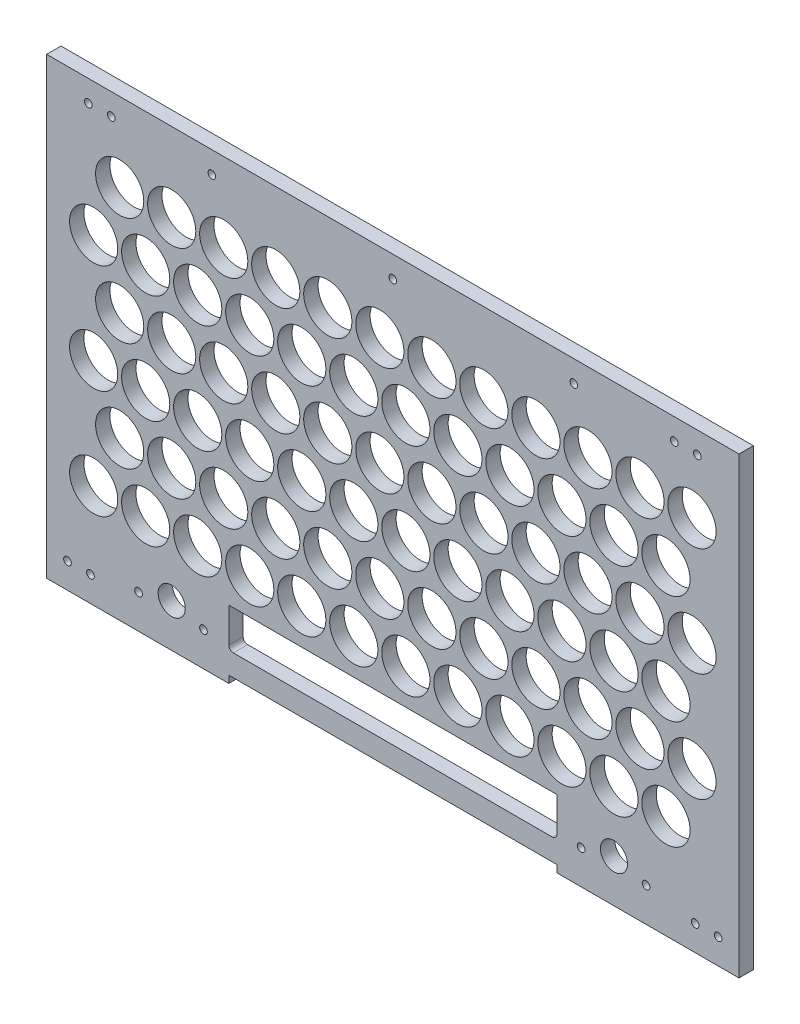
from build123d import *

# Parameters (mm, degrees)
SKETCH1_W                  = 306.05000007
SKETCH1_H                  = 197.4250001
BOSS_EXTRUDE1_DEPTH        = 6.35
SKETCH3_R                  = 10.6511979
CUT_EXTRUDE1_DEPTH         = 187.132543615
SKETCH4_R                  = 10.6511979
CUT_EXTRUDE2_DEPTH         = 187.132543615
LPATTERN1_COUNT            = 12
LPATTERN1_PITCH            = 23
LPATTERN2_COPY_1_SKETCH_R  = 10.6511979
LPATTERN2_COPY_1_DEPTH     = 187.132543615
LPATTERN2_COPY_2_SKETCH_R  = 10.6511979
LPATTERN2_COPY_2_DEPTH     = 187.132543615
LPATTERN2_COPY_3_SKETCH_R  = 10.6511979
LPATTERN2_COPY_3_DEPTH     = 187.132543615
LPATTERN2_COPY_4_SKETCH_R  = 10.6511979
LPATTERN2_COPY_4_DEPTH     = 187.132543615
LPATTERN2_COPY_5_SKETCH_R  = 10.6511979
LPATTERN2_COPY_5_DEPTH     = 187.132543615
LPATTERN2_COPY_6_SKETCH_R  = 10.6511979
LPATTERN2_COPY_6_DEPTH     = 187.132543615
LPATTERN2_COPY_7_SKETCH_R  = 10.6511979
LPATTERN2_COPY_7_DEPTH     = 187.132543615
LPATTERN2_COPY_8_SKETCH_R  = 10.6511979
LPATTERN2_COPY_8_DEPTH     = 187.132543615
LPATTERN2_COPY_9_SKETCH_R  = 10.6511979
LPATTERN2_COPY_9_DEPTH     = 187.132543615
LPATTERN2_COPY_10_SKETCH_R = 10.6511979
LPATTERN2_COPY_10_DEPTH    = 187.132543615
LPATTERN2_COPY_11_SKETCH_R = 10.6511979
LPATTERN2_COPY_11_DEPTH    = 187.132543615
LPATTERN2_COPY_12_SKETCH_R = 10.6511979
LPATTERN2_COPY_12_DEPTH    = 187.132543615
LPATTERN2_COPY_13_SKETCH_R = 10.6511979
LPATTERN2_COPY_13_DEPTH    = 187.132543615
LPATTERN2_COPY_14_SKETCH_R = 10.6511979
LPATTERN2_COPY_14_DEPTH    = 187.132543615
LPATTERN2_COPY_15_SKETCH_R = 10.6511979
LPATTERN2_COPY_15_DEPTH    = 187.132543615
LPATTERN2_COPY_16_SKETCH_R = 10.6511979
LPATTERN2_COPY_16_DEPTH    = 187.132543615
LPATTERN2_COPY_17_SKETCH_R = 10.6511979
LPATTERN2_COPY_17_DEPTH    = 187.132543615
LPATTERN2_COPY_18_SKETCH_R = 10.6511979
LPATTERN2_COPY_18_DEPTH    = 187.132543615
LPATTERN2_COPY_19_SKETCH_R = 10.6511979
LPATTERN2_COPY_19_DEPTH    = 187.132543615
LPATTERN2_COPY_20_SKETCH_R = 10.6511979
LPATTERN2_COPY_20_DEPTH    = 187.132543615
LPATTERN2_COPY_21_SKETCH_R = 10.6511979
LPATTERN2_COPY_21_DEPTH    = 187.132543615
LPATTERN2_COPY_22_SKETCH_R = 10.6511979
LPATTERN2_COPY_22_DEPTH    = 187.132543615
LPATTERN2_COPY_23_SKETCH_R = 10.6511979
LPATTERN2_COPY_23_DEPTH    = 187.132543615
LPATTERN2_COPY_24_SKETCH_R = 10.6511979
LPATTERN2_COPY_24_DEPTH    = 187.132543615
LPATTERN2_COPY_25_SKETCH_R = 10.6511979
LPATTERN2_COPY_25_DEPTH    = 187.132543615
LPATTERN2_COPY_26_SKETCH_R = 10.6511979
LPATTERN2_COPY_26_DEPTH    = 187.132543615
LPATTERN2_COPY_27_SKETCH_R = 10.6511979
LPATTERN2_COPY_27_DEPTH    = 187.132543615
LPATTERN2_COPY_28_SKETCH_R = 10.6511979
LPATTERN2_COPY_28_DEPTH    = 187.132543615
LPATTERN2_COPY_29_SKETCH_R = 10.6511979
LPATTERN2_COPY_29_DEPTH    = 187.132543615
LPATTERN2_COPY_30_SKETCH_R = 10.6511979
LPATTERN2_COPY_30_DEPTH    = 187.132543615
LPATTERN2_COPY_31_SKETCH_R = 10.6511979
LPATTERN2_COPY_31_DEPTH    = 187.132543615
LPATTERN2_COPY_32_SKETCH_R = 10.6511979
LPATTERN2_COPY_32_DEPTH    = 187.132543615
LPATTERN2_COPY_33_SKETCH_R = 10.6511979
LPATTERN2_COPY_33_DEPTH    = 187.132543615
LPATTERN2_COPY_34_SKETCH_R = 10.6511979
LPATTERN2_COPY_34_DEPTH    = 187.132543615
LPATTERN2_COPY_35_SKETCH_R = 10.6511979
LPATTERN2_COPY_35_DEPTH    = 187.132543615
LPATTERN2_COPY_36_SKETCH_R = 10.6511979
LPATTERN2_COPY_36_DEPTH    = 187.132543615
LPATTERN2_COPY_37_SKETCH_R = 10.6511979
LPATTERN2_COPY_37_DEPTH    = 187.132543615
LPATTERN2_COPY_38_SKETCH_R = 10.6511979
LPATTERN2_COPY_38_DEPTH    = 187.132543615
LPATTERN2_COPY_39_SKETCH_R = 10.6511979
LPATTERN2_COPY_39_DEPTH    = 187.132543615
LPATTERN2_COPY_40_SKETCH_R = 10.6511979
LPATTERN2_COPY_40_DEPTH    = 187.132543615
LPATTERN2_COPY_41_SKETCH_R = 10.6511979
LPATTERN2_COPY_41_DEPTH    = 187.132543615
LPATTERN2_COPY_42_SKETCH_R = 10.6511979
LPATTERN2_COPY_42_DEPTH    = 187.132543615
LPATTERN2_COPY_43_SKETCH_R = 10.6511979
LPATTERN2_COPY_43_DEPTH    = 187.132543615
LPATTERN2_COPY_44_SKETCH_R = 10.6511979
LPATTERN2_COPY_44_DEPTH    = 187.132543615
LPATTERN2_COPY_45_SKETCH_R = 10.6511979
LPATTERN2_COPY_45_DEPTH    = 187.132543615
LPATTERN2_COPY_46_SKETCH_R = 10.6511979
LPATTERN2_COPY_46_DEPTH    = 187.132543615
LPATTERN2_COPY_47_SKETCH_R = 10.6511979
LPATTERN2_COPY_47_DEPTH    = 187.132543615
LPATTERN2_COPY_48_SKETCH_R = 10.6511979
LPATTERN2_COPY_48_DEPTH    = 187.132543615
SKETCH13_W                 = 306.05000007
SKETCH13_H                 = 6.35
BOSS_EXTRUDE2_DEPTH        = 3.175
SKETCH14_R                 = 6
CUT_EXTRUDE3_DEPTH         = 187.132543615
M3_CLEARANCE_HOLE1_D       = 3.4
SKETCH18_W                 = 145
SKETCH18_H                 = 6.35
CUT_EXTRUDE5_DEPTH         = 30
SKETCH19_W                 = 145
SKETCH19_H                 = 9.525
BOSS_EXTRUDE3_DEPTH        = 6.35
FILLET2_R                  = 2


with BuildPart() as part:
    # Sketch1 → Boss-Extrude1 (new body)
    with BuildSketch(Plane.XY):
        with Locations((3.5e-08, -7.06250005)):
            Rectangle(SKETCH1_W, SKETCH1_H)
    extrude(amount=BOSS_EXTRUDE1_DEPTH)

    # Sketch3 → Cut-Extrude1 (cut, through all)
    with BuildSketch(Plane.XY.offset(6.35)):
        with Locations((-132.25, -60)):
            Circle(SKETCH3_R)
    cut_extrude1 = extrude(amount=-CUT_EXTRUDE1_DEPTH, mode=Mode.SUBTRACT)

    # Sketch4 → Cut-Extrude2 (cut, through all)
    with BuildSketch(Plane.XY.offset(6.35)):
        with Locations((-120.75, -36)):
            Circle(SKETCH4_R)
    cut_extrude2 = extrude(amount=-CUT_EXTRUDE2_DEPTH, mode=Mode.SUBTRACT)

    # LPattern1: Cut-Extrude1, Cut-Extrude2 ×12
    with Locations(*[(i * LPATTERN1_PITCH, 0, 0) for i in range(1, LPATTERN1_COUNT)]):
        add(cut_extrude1, mode=Mode.SUBTRACT)
        add(cut_extrude2, mode=Mode.SUBTRACT)

    # LPattern2 copy 1 sketch → LPattern2 copy 1 (cut, through all)
    with BuildSketch(Plane(origin=(23, 48, 6.35), x_dir=(1, 0, 0), z_dir=(0, 0, 1))):
        with Locations((-132.25, -60)):
            Circle(LPATTERN2_COPY_1_SKETCH_R)
    extrude(amount=-LPATTERN2_COPY_1_DEPTH, mode=Mode.SUBTRACT)

    # LPattern2 copy 2 sketch → LPattern2 copy 2 (cut, through all)
    with BuildSketch(Plane(origin=(23, 96, 6.35), x_dir=(1, 0, 0), z_dir=(0, 0, 1))):
        with Locations((-132.25, -60)):
            Circle(LPATTERN2_COPY_2_SKETCH_R)
    extrude(amount=-LPATTERN2_COPY_2_DEPTH, mode=Mode.SUBTRACT)

    # LPattern2 copy 3 sketch → LPattern2 copy 3 (cut, through all)
    with BuildSketch(Plane(origin=(46, 48, 6.35), x_dir=(1, 0, 0), z_dir=(0, 0, 1))):
        with Locations((-132.25, -60)):
            Circle(LPATTERN2_COPY_3_SKETCH_R)
    extrude(amount=-LPATTERN2_COPY_3_DEPTH, mode=Mode.SUBTRACT)

    # LPattern2 copy 4 sketch → LPattern2 copy 4 (cut, through all)
    with BuildSketch(Plane(origin=(46, 96, 6.35), x_dir=(1, 0, 0), z_dir=(0, 0, 1))):
        with Locations((-132.25, -60)):
            Circle(LPATTERN2_COPY_4_SKETCH_R)
    extrude(amount=-LPATTERN2_COPY_4_DEPTH, mode=Mode.SUBTRACT)

    # LPattern2 copy 5 sketch → LPattern2 copy 5 (cut, through all)
    with BuildSketch(Plane(origin=(69, 48, 6.35), x_dir=(1, 0, 0), z_dir=(0, 0, 1))):
        with Locations((-132.25, -60)):
            Circle(LPATTERN2_COPY_5_SKETCH_R)
    extrude(amount=-LPATTERN2_COPY_5_DEPTH, mode=Mode.SUBTRACT)

    # LPattern2 copy 6 sketch → LPattern2 copy 6 (cut, through all)
    with BuildSketch(Plane(origin=(69, 96, 6.35), x_dir=(1, 0, 0), z_dir=(0, 0, 1))):
        with Locations((-132.25, -60)):
            Circle(LPATTERN2_COPY_6_SKETCH_R)
    extrude(amount=-LPATTERN2_COPY_6_DEPTH, mode=Mode.SUBTRACT)

    # LPattern2 copy 7 sketch → LPattern2 copy 7 (cut, through all)
    with BuildSketch(Plane(origin=(92, 48, 6.35), x_dir=(1, 0, 0), z_dir=(0, 0, 1))):
        with Locations((-132.25, -60)):
            Circle(LPATTERN2_COPY_7_SKETCH_R)
    extrude(amount=-LPATTERN2_COPY_7_DEPTH, mode=Mode.SUBTRACT)

    # LPattern2 copy 8 sketch → LPattern2 copy 8 (cut, through all)
    with BuildSketch(Plane(origin=(92, 96, 6.35), x_dir=(1, 0, 0), z_dir=(0, 0, 1))):
        with Locations((-132.25, -60)):
            Circle(LPATTERN2_COPY_8_SKETCH_R)
    extrude(amount=-LPATTERN2_COPY_8_DEPTH, mode=Mode.SUBTRACT)

    # LPattern2 copy 9 sketch → LPattern2 copy 9 (cut, through all)
    with BuildSketch(Plane(origin=(115, 48, 6.35), x_dir=(1, 0, 0), z_dir=(0, 0, 1))):
        with Locations((-132.25, -60)):
            Circle(LPATTERN2_COPY_9_SKETCH_R)
    extrude(amount=-LPATTERN2_COPY_9_DEPTH, mode=Mode.SUBTRACT)

    # LPattern2 copy 10 sketch → LPattern2 copy 10 (cut, through all)
    with BuildSketch(Plane(origin=(115, 96, 6.35), x_dir=(1, 0, 0), z_dir=(0, 0, 1))):
        with Locations((-132.25, -60)):
            Circle(LPATTERN2_COPY_10_SKETCH_R)
    extrude(amount=-LPATTERN2_COPY_10_DEPTH, mode=Mode.SUBTRACT)

    # LPattern2 copy 11 sketch → LPattern2 copy 11 (cut, through all)
    with BuildSketch(Plane(origin=(138, 48, 6.35), x_dir=(1, 0, 0), z_dir=(0, 0, 1))):
        with Locations((-132.25, -60)):
            Circle(LPATTERN2_COPY_11_SKETCH_R)
    extrude(amount=-LPATTERN2_COPY_11_DEPTH, mode=Mode.SUBTRACT)

    # LPattern2 copy 12 sketch → LPattern2 copy 12 (cut, through all)
    with BuildSketch(Plane(origin=(138, 96, 6.35), x_dir=(1, 0, 0), z_dir=(0, 0, 1))):
        with Locations((-132.25, -60)):
            Circle(LPATTERN2_COPY_12_SKETCH_R)
    extrude(amount=-LPATTERN2_COPY_12_DEPTH, mode=Mode.SUBTRACT)

    # LPattern2 copy 13 sketch → LPattern2 copy 13 (cut, through all)
    with BuildSketch(Plane(origin=(161, 48, 6.35), x_dir=(1, 0, 0), z_dir=(0, 0, 1))):
        with Locations((-132.25, -60)):
            Circle(LPATTERN2_COPY_13_SKETCH_R)
    extrude(amount=-LPATTERN2_COPY_13_DEPTH, mode=Mode.SUBTRACT)

    # LPattern2 copy 14 sketch → LPattern2 copy 14 (cut, through all)
    with BuildSketch(Plane(origin=(161, 96, 6.35), x_dir=(1, 0, 0), z_dir=(0, 0, 1))):
        with Locations((-132.25, -60)):
            Circle(LPATTERN2_COPY_14_SKETCH_R)
    extrude(amount=-LPATTERN2_COPY_14_DEPTH, mode=Mode.SUBTRACT)

    # LPattern2 copy 15 sketch → LPattern2 copy 15 (cut, through all)
    with BuildSketch(Plane(origin=(184, 48, 6.35), x_dir=(1, 0, 0), z_dir=(0, 0, 1))):
        with Locations((-132.25, -60)):
            Circle(LPATTERN2_COPY_15_SKETCH_R)
    extrude(amount=-LPATTERN2_COPY_15_DEPTH, mode=Mode.SUBTRACT)

    # LPattern2 copy 16 sketch → LPattern2 copy 16 (cut, through all)
    with BuildSketch(Plane(origin=(184, 96, 6.35), x_dir=(1, 0, 0), z_dir=(0, 0, 1))):
        with Locations((-132.25, -60)):
            Circle(LPATTERN2_COPY_16_SKETCH_R)
    extrude(amount=-LPATTERN2_COPY_16_DEPTH, mode=Mode.SUBTRACT)

    # LPattern2 copy 17 sketch → LPattern2 copy 17 (cut, through all)
    with BuildSketch(Plane(origin=(207, 48, 6.35), x_dir=(1, 0, 0), z_dir=(0, 0, 1))):
        with Locations((-132.25, -60)):
            Circle(LPATTERN2_COPY_17_SKETCH_R)
    extrude(amount=-LPATTERN2_COPY_17_DEPTH, mode=Mode.SUBTRACT)

    # LPattern2 copy 18 sketch → LPattern2 copy 18 (cut, through all)
    with BuildSketch(Plane(origin=(207, 96, 6.35), x_dir=(1, 0, 0), z_dir=(0, 0, 1))):
        with Locations((-132.25, -60)):
            Circle(LPATTERN2_COPY_18_SKETCH_R)
    extrude(amount=-LPATTERN2_COPY_18_DEPTH, mode=Mode.SUBTRACT)

    # LPattern2 copy 19 sketch → LPattern2 copy 19 (cut, through all)
    with BuildSketch(Plane(origin=(230, 48, 6.35), x_dir=(1, 0, 0), z_dir=(0, 0, 1))):
        with Locations((-132.25, -60)):
            Circle(LPATTERN2_COPY_19_SKETCH_R)
    extrude(amount=-LPATTERN2_COPY_19_DEPTH, mode=Mode.SUBTRACT)

    # LPattern2 copy 20 sketch → LPattern2 copy 20 (cut, through all)
    with BuildSketch(Plane(origin=(230, 96, 6.35), x_dir=(1, 0, 0), z_dir=(0, 0, 1))):
        with Locations((-132.25, -60)):
            Circle(LPATTERN2_COPY_20_SKETCH_R)
    extrude(amount=-LPATTERN2_COPY_20_DEPTH, mode=Mode.SUBTRACT)

    # LPattern2 copy 21 sketch → LPattern2 copy 21 (cut, through all)
    with BuildSketch(Plane(origin=(253, 48, 6.35), x_dir=(1, 0, 0), z_dir=(0, 0, 1))):
        with Locations((-132.25, -60)):
            Circle(LPATTERN2_COPY_21_SKETCH_R)
    extrude(amount=-LPATTERN2_COPY_21_DEPTH, mode=Mode.SUBTRACT)

    # LPattern2 copy 22 sketch → LPattern2 copy 22 (cut, through all)
    with BuildSketch(Plane(origin=(253, 96, 6.35), x_dir=(1, 0, 0), z_dir=(0, 0, 1))):
        with Locations((-132.25, -60)):
            Circle(LPATTERN2_COPY_22_SKETCH_R)
    extrude(amount=-LPATTERN2_COPY_22_DEPTH, mode=Mode.SUBTRACT)

    # LPattern2 copy 23 sketch → LPattern2 copy 23 (cut, through all)
    with BuildSketch(Plane(origin=(23, 48, 6.35), x_dir=(1, 0, 0), z_dir=(0, 0, 1))):
        with Locations((-120.75, -36)):
            Circle(LPATTERN2_COPY_23_SKETCH_R)
    extrude(amount=-LPATTERN2_COPY_23_DEPTH, mode=Mode.SUBTRACT)

    # LPattern2 copy 24 sketch → LPattern2 copy 24 (cut, through all)
    with BuildSketch(Plane(origin=(23, 96, 6.35), x_dir=(1, 0, 0), z_dir=(0, 0, 1))):
        with Locations((-120.75, -36)):
            Circle(LPATTERN2_COPY_24_SKETCH_R)
    extrude(amount=-LPATTERN2_COPY_24_DEPTH, mode=Mode.SUBTRACT)

    # LPattern2 copy 25 sketch → LPattern2 copy 25 (cut, through all)
    with BuildSketch(Plane(origin=(46, 48, 6.35), x_dir=(1, 0, 0), z_dir=(0, 0, 1))):
        with Locations((-120.75, -36)):
            Circle(LPATTERN2_COPY_25_SKETCH_R)
    extrude(amount=-LPATTERN2_COPY_25_DEPTH, mode=Mode.SUBTRACT)

    # LPattern2 copy 26 sketch → LPattern2 copy 26 (cut, through all)
    with BuildSketch(Plane(origin=(46, 96, 6.35), x_dir=(1, 0, 0), z_dir=(0, 0, 1))):
        with Locations((-120.75, -36)):
            Circle(LPATTERN2_COPY_26_SKETCH_R)
    extrude(amount=-LPATTERN2_COPY_26_DEPTH, mode=Mode.SUBTRACT)

    # LPattern2 copy 27 sketch → LPattern2 copy 27 (cut, through all)
    with BuildSketch(Plane(origin=(69, 48, 6.35), x_dir=(1, 0, 0), z_dir=(0, 0, 1))):
        with Locations((-120.75, -36)):
            Circle(LPATTERN2_COPY_27_SKETCH_R)
    extrude(amount=-LPATTERN2_COPY_27_DEPTH, mode=Mode.SUBTRACT)

    # LPattern2 copy 28 sketch → LPattern2 copy 28 (cut, through all)
    with BuildSketch(Plane(origin=(69, 96, 6.35), x_dir=(1, 0, 0), z_dir=(0, 0, 1))):
        with Locations((-120.75, -36)):
            Circle(LPATTERN2_COPY_28_SKETCH_R)
    extrude(amount=-LPATTERN2_COPY_28_DEPTH, mode=Mode.SUBTRACT)

    # LPattern2 copy 29 sketch → LPattern2 copy 29 (cut, through all)
    with BuildSketch(Plane(origin=(92, 48, 6.35), x_dir=(1, 0, 0), z_dir=(0, 0, 1))):
        with Locations((-120.75, -36)):
            Circle(LPATTERN2_COPY_29_SKETCH_R)
    extrude(amount=-LPATTERN2_COPY_29_DEPTH, mode=Mode.SUBTRACT)

    # LPattern2 copy 30 sketch → LPattern2 copy 30 (cut, through all)
    with BuildSketch(Plane(origin=(92, 96, 6.35), x_dir=(1, 0, 0), z_dir=(0, 0, 1))):
        with Locations((-120.75, -36)):
            Circle(LPATTERN2_COPY_30_SKETCH_R)
    extrude(amount=-LPATTERN2_COPY_30_DEPTH, mode=Mode.SUBTRACT)

    # LPattern2 copy 31 sketch → LPattern2 copy 31 (cut, through all)
    with BuildSketch(Plane(origin=(115, 48, 6.35), x_dir=(1, 0, 0), z_dir=(0, 0, 1))):
        with Locations((-120.75, -36)):
            Circle(LPATTERN2_COPY_31_SKETCH_R)
    extrude(amount=-LPATTERN2_COPY_31_DEPTH, mode=Mode.SUBTRACT)

    # LPattern2 copy 32 sketch → LPattern2 copy 32 (cut, through all)
    with BuildSketch(Plane(origin=(115, 96, 6.35), x_dir=(1, 0, 0), z_dir=(0, 0, 1))):
        with Locations((-120.75, -36)):
            Circle(LPATTERN2_COPY_32_SKETCH_R)
    extrude(amount=-LPATTERN2_COPY_32_DEPTH, mode=Mode.SUBTRACT)

    # LPattern2 copy 33 sketch → LPattern2 copy 33 (cut, through all)
    with BuildSketch(Plane(origin=(138, 48, 6.35), x_dir=(1, 0, 0), z_dir=(0, 0, 1))):
        with Locations((-120.75, -36)):
            Circle(LPATTERN2_COPY_33_SKETCH_R)
    extrude(amount=-LPATTERN2_COPY_33_DEPTH, mode=Mode.SUBTRACT)

    # LPattern2 copy 34 sketch → LPattern2 copy 34 (cut, through all)
    with BuildSketch(Plane(origin=(138, 96, 6.35), x_dir=(1, 0, 0), z_dir=(0, 0, 1))):
        with Locations((-120.75, -36)):
            Circle(LPATTERN2_COPY_34_SKETCH_R)
    extrude(amount=-LPATTERN2_COPY_34_DEPTH, mode=Mode.SUBTRACT)

    # LPattern2 copy 35 sketch → LPattern2 copy 35 (cut, through all)
    with BuildSketch(Plane(origin=(161, 48, 6.35), x_dir=(1, 0, 0), z_dir=(0, 0, 1))):
        with Locations((-120.75, -36)):
            Circle(LPATTERN2_COPY_35_SKETCH_R)
    extrude(amount=-LPATTERN2_COPY_35_DEPTH, mode=Mode.SUBTRACT)

    # LPattern2 copy 36 sketch → LPattern2 copy 36 (cut, through all)
    with BuildSketch(Plane(origin=(161, 96, 6.35), x_dir=(1, 0, 0), z_dir=(0, 0, 1))):
        with Locations((-120.75, -36)):
            Circle(LPATTERN2_COPY_36_SKETCH_R)
    extrude(amount=-LPATTERN2_COPY_36_DEPTH, mode=Mode.SUBTRACT)

    # LPattern2 copy 37 sketch → LPattern2 copy 37 (cut, through all)
    with BuildSketch(Plane(origin=(184, 48, 6.35), x_dir=(1, 0, 0), z_dir=(0, 0, 1))):
        with Locations((-120.75, -36)):
            Circle(LPATTERN2_COPY_37_SKETCH_R)
    extrude(amount=-LPATTERN2_COPY_37_DEPTH, mode=Mode.SUBTRACT)

    # LPattern2 copy 38 sketch → LPattern2 copy 38 (cut, through all)
    with BuildSketch(Plane(origin=(184, 96, 6.35), x_dir=(1, 0, 0), z_dir=(0, 0, 1))):
        with Locations((-120.75, -36)):
            Circle(LPATTERN2_COPY_38_SKETCH_R)
    extrude(amount=-LPATTERN2_COPY_38_DEPTH, mode=Mode.SUBTRACT)

    # LPattern2 copy 39 sketch → LPattern2 copy 39 (cut, through all)
    with BuildSketch(Plane(origin=(207, 48, 6.35), x_dir=(1, 0, 0), z_dir=(0, 0, 1))):
        with Locations((-120.75, -36)):
            Circle(LPATTERN2_COPY_39_SKETCH_R)
    extrude(amount=-LPATTERN2_COPY_39_DEPTH, mode=Mode.SUBTRACT)

    # LPattern2 copy 40 sketch → LPattern2 copy 40 (cut, through all)
    with BuildSketch(Plane(origin=(207, 96, 6.35), x_dir=(1, 0, 0), z_dir=(0, 0, 1))):
        with Locations((-120.75, -36)):
            Circle(LPATTERN2_COPY_40_SKETCH_R)
    extrude(amount=-LPATTERN2_COPY_40_DEPTH, mode=Mode.SUBTRACT)

    # LPattern2 copy 41 sketch → LPattern2 copy 41 (cut, through all)
    with BuildSketch(Plane(origin=(230, 48, 6.35), x_dir=(1, 0, 0), z_dir=(0, 0, 1))):
        with Locations((-120.75, -36)):
            Circle(LPATTERN2_COPY_41_SKETCH_R)
    extrude(amount=-LPATTERN2_COPY_41_DEPTH, mode=Mode.SUBTRACT)

    # LPattern2 copy 42 sketch → LPattern2 copy 42 (cut, through all)
    with BuildSketch(Plane(origin=(230, 96, 6.35), x_dir=(1, 0, 0), z_dir=(0, 0, 1))):
        with Locations((-120.75, -36)):
            Circle(LPATTERN2_COPY_42_SKETCH_R)
    extrude(amount=-LPATTERN2_COPY_42_DEPTH, mode=Mode.SUBTRACT)

    # LPattern2 copy 43 sketch → LPattern2 copy 43 (cut, through all)
    with BuildSketch(Plane(origin=(253, 48, 6.35), x_dir=(1, 0, 0), z_dir=(0, 0, 1))):
        with Locations((-120.75, -36)):
            Circle(LPATTERN2_COPY_43_SKETCH_R)
    extrude(amount=-LPATTERN2_COPY_43_DEPTH, mode=Mode.SUBTRACT)

    # LPattern2 copy 44 sketch → LPattern2 copy 44 (cut, through all)
    with BuildSketch(Plane(origin=(253, 96, 6.35), x_dir=(1, 0, 0), z_dir=(0, 0, 1))):
        with Locations((-120.75, -36)):
            Circle(LPATTERN2_COPY_44_SKETCH_R)
    extrude(amount=-LPATTERN2_COPY_44_DEPTH, mode=Mode.SUBTRACT)

    # LPattern2 copy 45 sketch → LPattern2 copy 45 (cut, through all)
    with BuildSketch(Plane(origin=(0, 48, 6.35), x_dir=(1, 0, 0), z_dir=(0, 0, 1))):
        with Locations((-132.25, -60)):
            Circle(LPATTERN2_COPY_45_SKETCH_R)
    extrude(amount=-LPATTERN2_COPY_45_DEPTH, mode=Mode.SUBTRACT)

    # LPattern2 copy 46 sketch → LPattern2 copy 46 (cut, through all)
    with BuildSketch(Plane(origin=(0, 96, 6.35), x_dir=(1, 0, 0), z_dir=(0, 0, 1))):
        with Locations((-132.25, -60)):
            Circle(LPATTERN2_COPY_46_SKETCH_R)
    extrude(amount=-LPATTERN2_COPY_46_DEPTH, mode=Mode.SUBTRACT)

    # LPattern2 copy 47 sketch → LPattern2 copy 47 (cut, through all)
    with BuildSketch(Plane(origin=(0, 48, 6.35), x_dir=(1, 0, 0), z_dir=(0, 0, 1))):
        with Locations((-120.75, -36)):
            Circle(LPATTERN2_COPY_47_SKETCH_R)
    extrude(amount=-LPATTERN2_COPY_47_DEPTH, mode=Mode.SUBTRACT)

    # LPattern2 copy 48 sketch → LPattern2 copy 48 (cut, through all)
    with BuildSketch(Plane(origin=(0, 96, 6.35), x_dir=(1, 0, 0), z_dir=(0, 0, 1))):
        with Locations((-120.75, -36)):
            Circle(LPATTERN2_COPY_48_SKETCH_R)
    extrude(amount=-LPATTERN2_COPY_48_DEPTH, mode=Mode.SUBTRACT)

    # Sketch13 → Boss-Extrude2 (add)
    with BuildSketch(Plane(origin=(0, 91.65, 0), x_dir=(1, 0, 0), z_dir=(0, 1, 0))):
        with Locations((3.5e-08, -3.175)):
            Rectangle(SKETCH13_W, SKETCH13_H)
    extrude(amount=BOSS_EXTRUDE2_DEPTH)

    # Sketch14 → Cut-Extrude3 (cut, through all)
    with BuildSketch(Plane(origin=(0, 0, 0), x_dir=(-1, 0, 0), z_dir=(0, 0, -1))):
        with Locations((-97.75, -86.7750001)):
            Circle(SKETCH14_R)
    cut_extrude3 = extrude(amount=-CUT_EXTRUDE3_DEPTH, mode=Mode.SUBTRACT)

    # Mirror1: Cut-Extrude3 across plane
    add(cut_extrude3.mirror(Plane(origin=(0, 0, 0), x_dir=(0, 0, 1), z_dir=(1, 0, 0))), mode=Mode.SUBTRACT)

    # M3 Clearance Hole1 (through all)
    with Locations(Plane(origin=(0, 0, 0), x_dir=(-1, 0, 0), z_dir=(0, 0, -1))):
        with Locations((-111.94, -90.775), (-83.25, -90.775), (83.712, -90.775), (80, 85.3), (0, 85.3), (-80, 85.3), (112.402, -90.775), (-143.817500066, -94.6000001), (-133.657500066, -94.6000001), (-134.610000066, 85.3), (-124.450000066, 85.3), (124.450000066, 85.3), (134.610000066, 85.3), (133.657500066, -94.6000001), (143.817500066, -94.6000001)):
            Hole(M3_CLEARANCE_HOLE1_D / 2)

    # Sketch18 → Cut-Extrude5 (cut)
    with BuildSketch(Plane.XZ.offset(105.7750001)):
        with Locations((0, 3.175)):
            Rectangle(SKETCH18_W, SKETCH18_H)
    extrude(amount=-CUT_EXTRUDE5_DEPTH, mode=Mode.SUBTRACT)

    # Sketch19 → Boss-Extrude3 (add)
    with BuildSketch(Plane(origin=(0, 0, 0), x_dir=(-1, 0, 0), z_dir=(0, 0, -1))):
        with Locations((0, -97.8375001)):
            Rectangle(SKETCH19_W, SKETCH19_H)
    extrude(amount=-BOSS_EXTRUDE3_DEPTH)

    # Fillet2
    fillet2_edges = [part.edges().sort_by_distance(p)[0] for p in [
        (72.5, -93.0750001, 3.175),
        (-72.5, -93.0750001, 3.175),
    ]]
    fillet(fillet2_edges, radius=FILLET2_R)


solid = part.part
